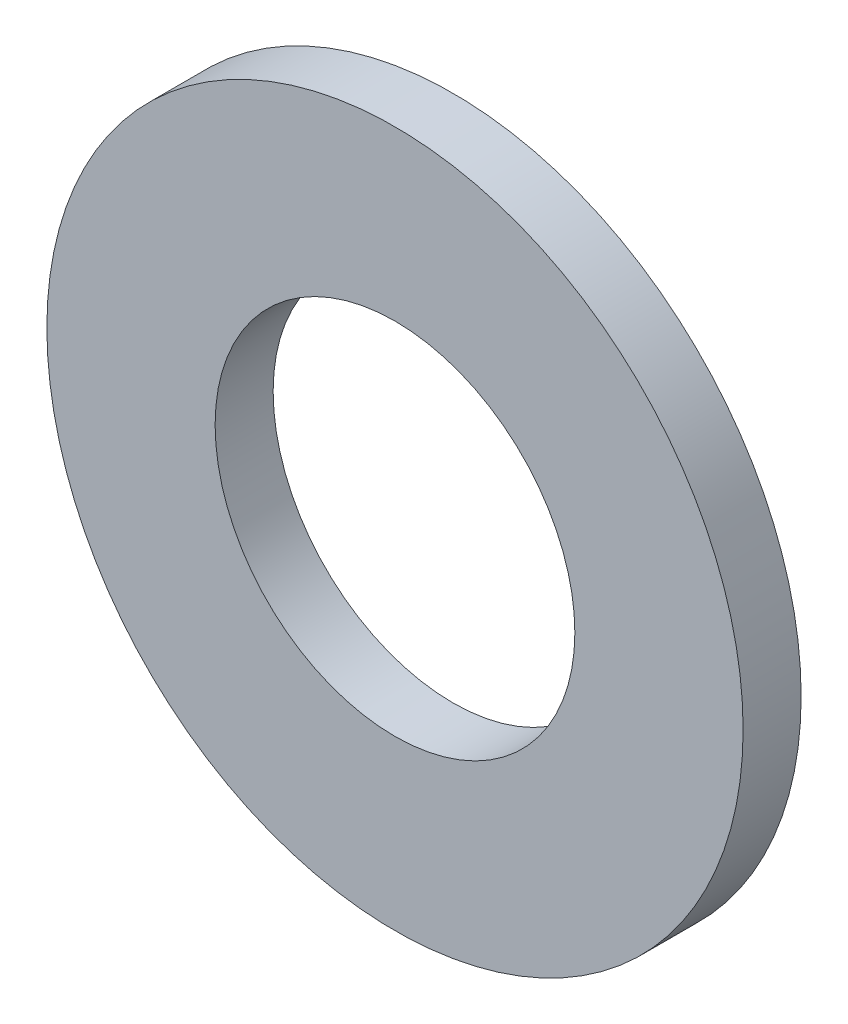
from build123d import *

# Parameters (mm, degrees)
SKETCH_1_R      = 6
SKETCH_1_R_2    = 3.1
EXTRUDE_1_DEPTH = 1


with BuildPart() as part:
    # 스케치1 → 보스-돌출1 (new body)
    with BuildSketch(Plane.XY):
        Circle(SKETCH_1_R)
        Circle(SKETCH_1_R_2, mode=Mode.SUBTRACT)
    extrude(amount=EXTRUDE_1_DEPTH)


solid = part.part
